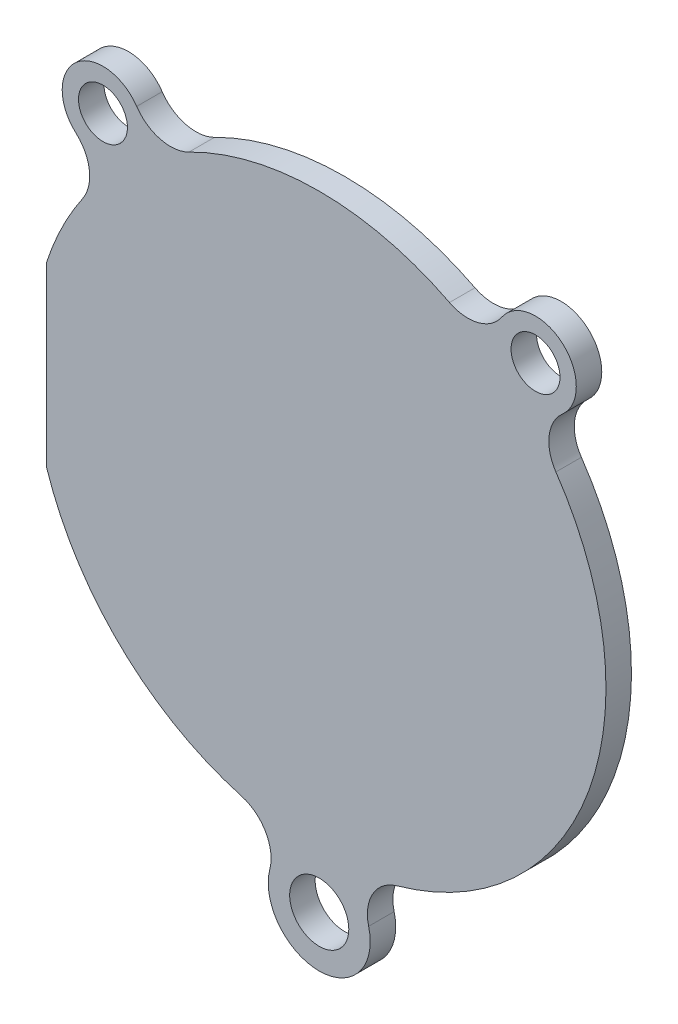
from build123d import *

# Parameters (mm, degrees)
SKETCH1_R           = 1.8415
SKETCH1_R_2         = 1.524
BOSS_EXTRUDE1_DEPTH = 1.5875


with BuildPart() as part:
    # Sketch1 → Boss-Extrude1 (new body)
    with BuildSketch(Plane.XY):
        with BuildLine():
            Line((-16.984058744, -5.5245), (-16.984058744, 5.5245))
            ThreePointArc((-16.984058744, 5.5245), (-16.025769731, 7.883720963), (-14.741706386, 10.082680423))
            ThreePointArc((-14.741706386, 10.082680423), (-14.317457481, 11.828509895), (-15.154421031, 13.418289658))
            ThreePointArc((-15.154421031, 13.418289658), (-15.147832175, 17.227454165), (-11.369129629, 16.746637442))
            ThreePointArc((-11.369129629, 16.746637442), (-9.89949783, 15.713153019), (-8.113736976, 15.910550712))
            ThreePointArc((-8.113736976, 15.910550712), (0, 17.859965052), (8.113736976, 15.910550712))
            ThreePointArc((8.113736976, 15.910550712), (9.89949783, 15.713153019), (11.369129629, 16.746637442))
            ThreePointArc((11.369129629, 16.746637442), (15.147832175, 17.227454165), (15.154421031, 13.418289658))
            ThreePointArc((15.154421031, 13.418289658), (14.317457481, 11.828509895), (14.741706386, 10.082680423))
            ThreePointArc((14.741706386, 10.082680423), (16.789759308, -6.089526588), (4.850582957, -17.188664772))
            ThreePointArc((4.850582957, -17.188664772), (3.34119056, -18.362373067), (3.078011585, -20.256203417))
            ThreePointArc((3.078011585, -20.256203417), (0, -24.209965052), (-3.078011585, -20.256203417))
            ThreePointArc((-3.078011585, -20.256203417), (-3.34119056, -18.362373067), (-4.850582957, -17.188664772))
            ThreePointArc((-4.850582957, -17.188664772), (-12.377442365, -12.875452309), (-16.984058744, -5.5245))
        make_face()
        with Locations((0, -21.034965052)):
            Circle(SKETCH1_R, mode=Mode.SUBTRACT)
        with Locations((-13.470606702, 15.319965052)):
            Circle(SKETCH1_R_2, mode=Mode.SUBTRACT)
        with Locations((13.470606702, 15.319965052)):
            Circle(SKETCH1_R_2, mode=Mode.SUBTRACT)
    extrude(amount=BOSS_EXTRUDE1_DEPTH)


solid = part.part
